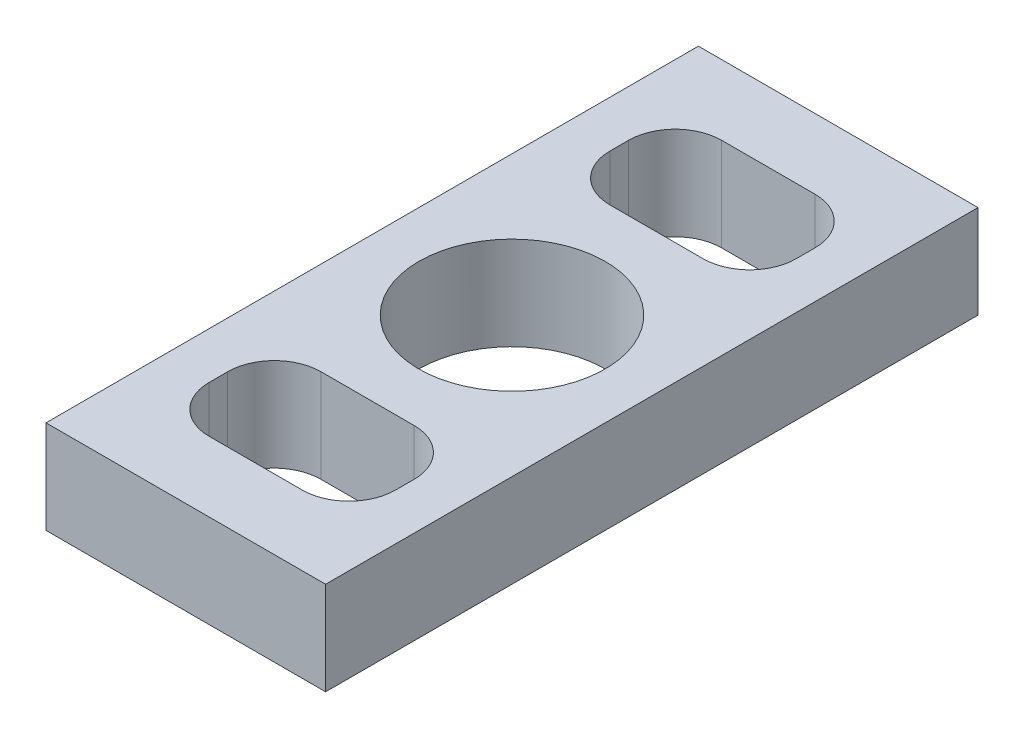
from build123d import *

# Parameters (mm, degrees)
SKETCH1_W           = 38.1
SKETCH1_H           = 12.7
BOSS_EXTRUDE1_DEPTH = 88.9
SKETCH2_R           = 12.7
CUT_EXTRUDE1_DEPTH  = 88.9
SKETCH3_W           = 25.4
SKETCH3_H           = 15.24
CUT_EXTRUDE2_DEPTH  = 12.7
FILLET1_R           = 6.35


with BuildPart() as part:
    # Sketch1 → Boss-Extrude1 (new body)
    with BuildSketch(Plane.XY):
        with Locations((-5.693103448, -0.218965517)):
            Rectangle(SKETCH1_W, SKETCH1_H)
    extrude(amount=BOSS_EXTRUDE1_DEPTH)

    # Sketch2 → Cut-Extrude1 (cut)
    with BuildSketch(Plane(origin=(0, 6.131034483, 0), x_dir=(1, 0, 0), z_dir=(0, 1, 0))):
        with Locations(Location((-5.693103448, -44.45, 0), (0, 0, 180))):
            Circle(SKETCH2_R)
    extrude(amount=-CUT_EXTRUDE1_DEPTH, mode=Mode.SUBTRACT)

    # Sketch3 → Cut-Extrude2 (cut)
    with BuildSketch(Plane(origin=(0, 6.131034483, 0), x_dir=(1, 0, 0), z_dir=(0, 1, 0))):
        with Locations((-5.693103448, -17.145)):
            Rectangle(SKETCH3_W, SKETCH3_H)
        with Locations((-5.693103448, -71.755)):
            Rectangle(SKETCH3_W, SKETCH3_H)
    extrude(amount=-CUT_EXTRUDE2_DEPTH, mode=Mode.SUBTRACT)

    # Fillet1
    fillet1_edges = [part.edges().sort_by_distance(p)[0] for p in [
        (-18.393103448, -0.218965517, 24.765),
        (-18.393103448, -0.218965517, 9.525),
        (7.006896552, -0.218965517, 9.525),
        (7.006896552, -0.218965517, 24.765),
        (-18.393103448, -0.218965517, 79.375),
        (-18.393103448, -0.218965517, 64.135),
        (7.006896552, -0.218965517, 64.135),
        (7.006896552, -0.218965517, 79.375),
    ]]
    fillet(fillet1_edges, radius=FILLET1_R)


solid = part.part
